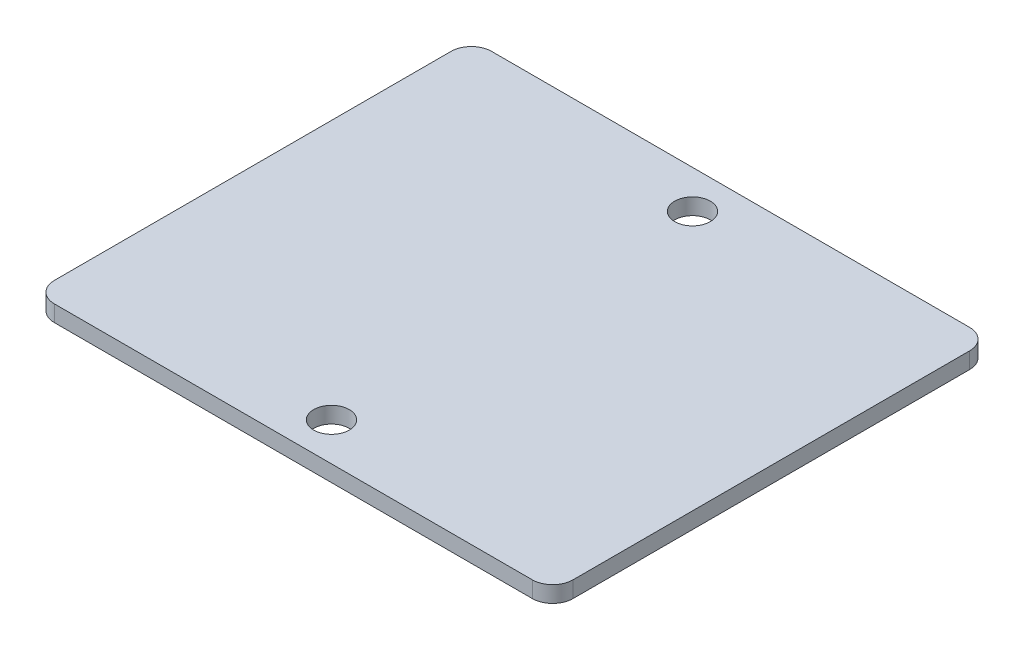
from build123d import *

# Parameters (mm, degrees)
SKETCH1_W           = 51
SKETCH1_H           = 43
SKETCH1_R           = 1.75
BOSS_EXTRUDE1_DEPTH = 1.6
FILLET1_R           = 2


with BuildPart() as part:
    # Sketch1 → Boss-Extrude1 (new body)
    with BuildSketch(Plane(origin=(0, 0, 0), x_dir=(1, 0, 0), z_dir=(0, 1, 0))):
        Rectangle(SKETCH1_W, SKETCH1_H)
        with Locations(Location((0, 17.75, 0), (0, 0, 270))):
            Circle(SKETCH1_R, mode=Mode.SUBTRACT)
        with Locations(Location((0, -17.75, 0), (0, 0, 270))):
            Circle(SKETCH1_R, mode=Mode.SUBTRACT)
    extrude(amount=BOSS_EXTRUDE1_DEPTH)

    # Fillet1
    fillet1_edges = [part.edges().sort_by_distance(p)[0] for p in [
        (25.5, 0.8, 21.5),
        (-25.5, 0.8, 21.5),
        (-25.5, 0.8, -21.5),
        (25.5, 0.8, -21.5),
    ]]
    fillet(fillet1_edges, radius=FILLET1_R)


solid = part.part
